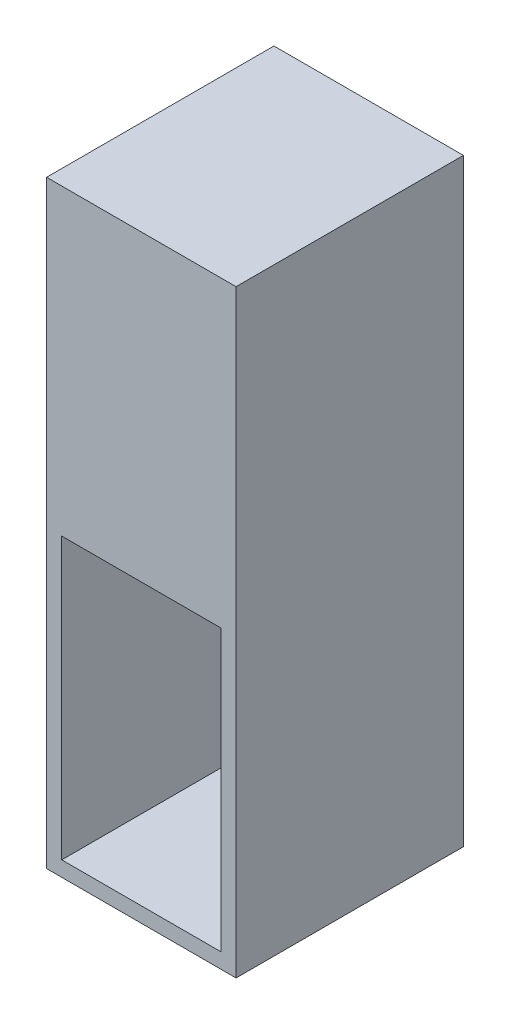
from build123d import *

# Parameters (mm, degrees)
SKETCH1_W           = 25
SKETCH1_H           = 79
BOSS_EXTRUDE1_DEPTH = 30
SKETCH2_W           = 21
SKETCH2_H           = 37
CUT_EXTRUDE1_DEPTH  = 30


with BuildPart() as part:
    # Sketch1 → Boss-Extrude1 (new body)
    with BuildSketch(Plane.XY):
        with Locations((-76.876286082, 15.968177547)):
            Rectangle(SKETCH1_W, SKETCH1_H)
    extrude(amount=BOSS_EXTRUDE1_DEPTH)

    # Sketch2 → Cut-Extrude1 (cut)
    with BuildSketch(Plane.XY.offset(30)):
        with Locations((-76.876286082, -3.031822453)):
            Rectangle(SKETCH2_W, SKETCH2_H)
    extrude(amount=-CUT_EXTRUDE1_DEPTH, mode=Mode.SUBTRACT)


solid = part.part
